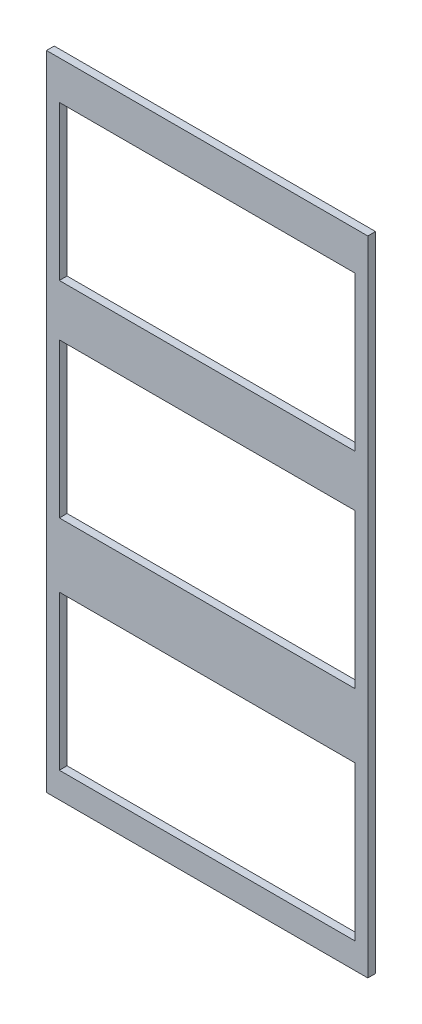
from build123d import *

# Parameters (mm, degrees)
ESBO_O1_W                = 250
ESBO_O1_H                = 500
RESSALTO_EXTRUS_O1_DEPTH = 6
ESBO_O2_W                = 230
ESBO_O2_H                = 120
CORTE_EXTRUS_O1_DEPTH    = 560.049192827


with BuildPart() as part:
    # Esboço1 → Ressalto-extrusão1 (new body)
    with BuildSketch(Plane.XY):
        with Locations((125, -250)):
            Rectangle(ESBO_O1_W, ESBO_O1_H)
    extrude(amount=RESSALTO_EXTRUS_O1_DEPTH)

    # Esboço2 → Corte-extrusão1 (cut, through all)
    with BuildSketch(Plane(origin=(0, 0, 0), x_dir=(-1, 0, 0), z_dir=(0, 0, -1))):
        with Locations((-125, -90)):
            Rectangle(ESBO_O2_W, ESBO_O2_H)
        with Locations((-125, -250)):
            Rectangle(ESBO_O2_W, ESBO_O2_H)
        with Locations((-125, -420)):
            Rectangle(ESBO_O2_W, ESBO_O2_H)
    extrude(amount=-CORTE_EXTRUS_O1_DEPTH, mode=Mode.SUBTRACT)


solid = part.part
